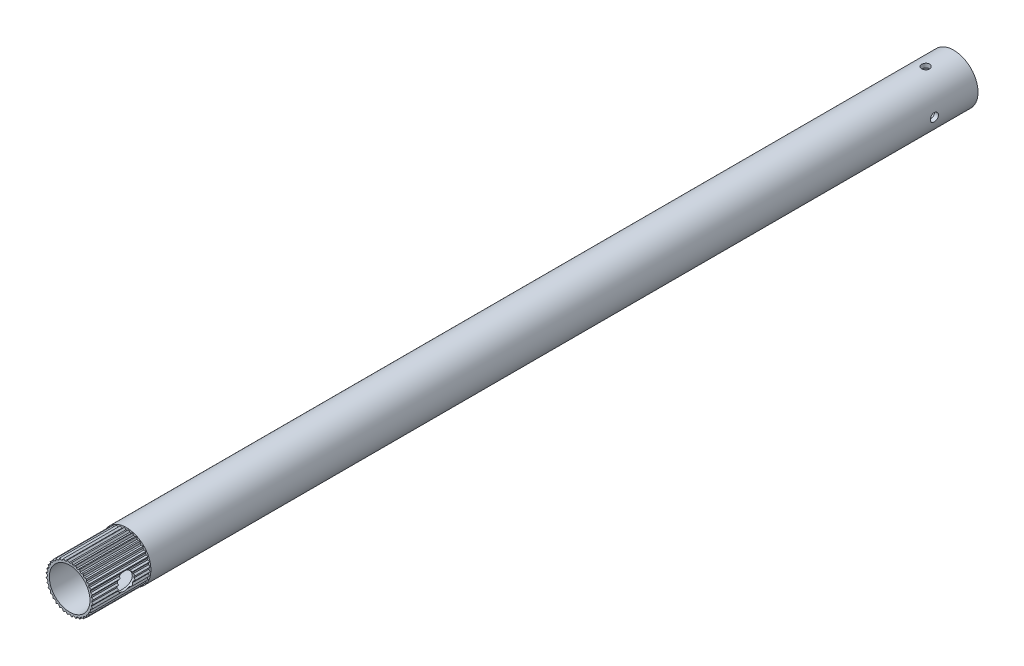
from build123d import *

# Parameters (mm, degrees)
SKETCH5_W               = 1.587499994
SKETCH5_H               = 345.340081988
CUT_EXTRUDE5_DEPTH      = 368.748370511
CUT_EXTRUDE5_DEPTH_BACK = 368.748370511
SKETCH7_R               = 1.5875
SKETCH7_R_2             = 3.3782
CUT_EXTRUDE6_DEPTH      = 368.748370616
CUT_EXTRUDE6_DEPTH_BACK = 368.748370616
SKETCH6_R               = 1.5875
CUT_EXTRUDE7_START      = 367.501582
SKETCH8_R               = 12.7
CUT_EXTRUDE7_DEPTH      = 22.225


with BuildPart() as part:
    # Sketch5 → Revolve2 (revolve)
    with BuildSketch(Plane(origin=(0, 0, 0), x_dir=(1, 0, 0), z_dir=(0, 1, 0)), mode=Mode.PRIVATE) as revolve2_sk:
        with Locations((8.731249997, -194.831540994)):
            Rectangle(SKETCH5_W, SKETCH5_H)
    revolve(revolve2_sk.sketch.rotate(Axis((0, 0, 0), (0, 0, 1)), 180), axis=Axis((0, 0, 0), (0, 0, 1)))

    # Sketch7 → Cut-Extrude5 (cut, two sides: drawn at the far end of the back side and taken through both)
    with BuildSketch(Plane(origin=(0, 0, 0), x_dir=(0, 0, -1), z_dir=(1, 0, 0)).offset(-CUT_EXTRUDE5_DEPTH_BACK)):
        with Locations((-39.195999993, 0)):
            Circle(SKETCH7_R)
        with Locations((-354.347981988, 0)):
            Circle(SKETCH7_R_2)
    extrude(amount=CUT_EXTRUDE5_DEPTH + CUT_EXTRUDE5_DEPTH_BACK, mode=Mode.SUBTRACT)

    # Sketch6 → Cut-Extrude6 (cut, two sides: drawn at the far end of the back side and taken through both)
    with BuildSketch(Plane(origin=(0, 0, 0), x_dir=(1, 0, 0), z_dir=(0, 1, 0)).offset(-CUT_EXTRUDE6_DEPTH_BACK)):
        with Locations(Location((1e-09, -33.163499999, 0), (0, 0, 269.999999955))):
            Circle(SKETCH6_R)
    extrude(amount=CUT_EXTRUDE6_DEPTH + CUT_EXTRUDE6_DEPTH_BACK, mode=Mode.SUBTRACT)

    # Sketch8 → Cut-Extrude7 (cut)
    with BuildSketch(Plane.XY.offset(CUT_EXTRUDE7_START)):
        Circle(SKETCH8_R)
        Polygon((9.235721046, -0.808020891), (8.681700155, -0.254), (8.681700155, 0.254), (9.235721046, 0.808020891), (8.593912259, 1.257420242), (8.505698985, 1.75770258), (8.955098336, 2.399511367), (8.245002688, 2.730634406), (8.071256455, 3.207998257), (8.402379494, 3.918093905), (7.645572882, 4.120879625), (7.391572882, 4.56082053), (7.594358603, 5.317627141), (6.813836213, 5.385914002), (6.487300108, 5.775064579), (6.555586968, 6.555586968), (5.775064579, 6.487300108), (5.385914002, 6.813836213), (5.317627141, 7.594358603), (4.56082053, 7.391572882), (4.120879625, 7.645572882), (3.918093905, 8.402379494), (3.207998257, 8.071256455), (2.730634406, 8.245002688), (2.399511367, 8.955098336), (1.75770258, 8.505698985), (1.257420242, 8.593912259), (0.808020891, 9.235721046), (0.254, 8.681700155), (-0.254, 8.681700155), (-0.808020891, 9.235721046), (-1.257420242, 8.593912259), (-1.75770258, 8.505698985), (-2.399511367, 8.955098336), (-2.730634406, 8.245002688), (-3.207998257, 8.071256455), (-3.918093905, 8.402379494), (-4.120879625, 7.645572882), (-4.56082053, 7.391572882), (-5.317627141, 7.594358603), (-5.385914002, 6.813836213), (-5.775064579, 6.487300108), (-6.555586968, 6.555586968), (-6.487300108, 5.775064579), (-6.813836213, 5.385914002), (-7.594358603, 5.317627141), (-7.391572882, 4.56082053), (-7.645572882, 4.120879625), (-8.402379494, 3.918093905), (-8.071256455, 3.207998257), (-8.245002688, 2.730634406), (-8.955098336, 2.399511367), (-8.505698985, 1.75770258), (-8.593912259, 1.257420242), (-9.235721046, 0.808020891), (-8.681700155, 0.254), (-8.681700155, -0.254), (-9.235721046, -0.808020891), (-8.593912259, -1.257420242), (-8.505698985, -1.75770258), (-8.955098336, -2.399511367), (-8.245002688, -2.730634406), (-8.071256455, -3.207998257), (-8.402379494, -3.918093905), (-7.645572882, -4.120879625), (-7.391572882, -4.56082053), (-7.594358603, -5.317627141), (-6.813836213, -5.385914002), (-6.487300108, -5.775064579), (-6.555586968, -6.555586968), (-5.775064579, -6.487300108), (-5.385914002, -6.813836213), (-5.317627141, -7.594358603), (-4.56082053, -7.391572882), (-4.120879625, -7.645572882), (-3.918093905, -8.402379494), (-3.207998257, -8.071256455), (-2.730634406, -8.245002688), (-2.399511367, -8.955098336), (-1.75770258, -8.505698985), (-1.257420242, -8.593912259), (-0.808020891, -9.235721046), (-0.254, -8.681700155), (0.254, -8.681700155), (0.808020891, -9.235721046), (1.257420242, -8.593912259), (1.75770258, -8.505698985), (2.399511367, -8.955098336), (2.730634406, -8.245002688), (3.207998257, -8.071256455), (3.918093905, -8.402379494), (4.120879625, -7.645572882), (4.56082053, -7.391572882), (5.317627141, -7.594358603), (5.385914002, -6.813836213), (5.775064579, -6.487300108), (6.555586968, -6.555586968), (6.487300108, -5.775064579), (6.813836213, -5.385914002), (7.594358603, -5.317627141), (7.391572882, -4.56082053), (7.645572882, -4.120879625), (8.402379494, -3.918093905), (8.071256455, -3.207998257), (8.245002688, -2.730634406), (8.955098336, -2.399511367), (8.505698985, -1.75770258), (8.593912259, -1.257420242), align=None, mode=Mode.SUBTRACT)
    extrude(amount=-CUT_EXTRUDE7_DEPTH, mode=Mode.SUBTRACT)


solid = part.part
